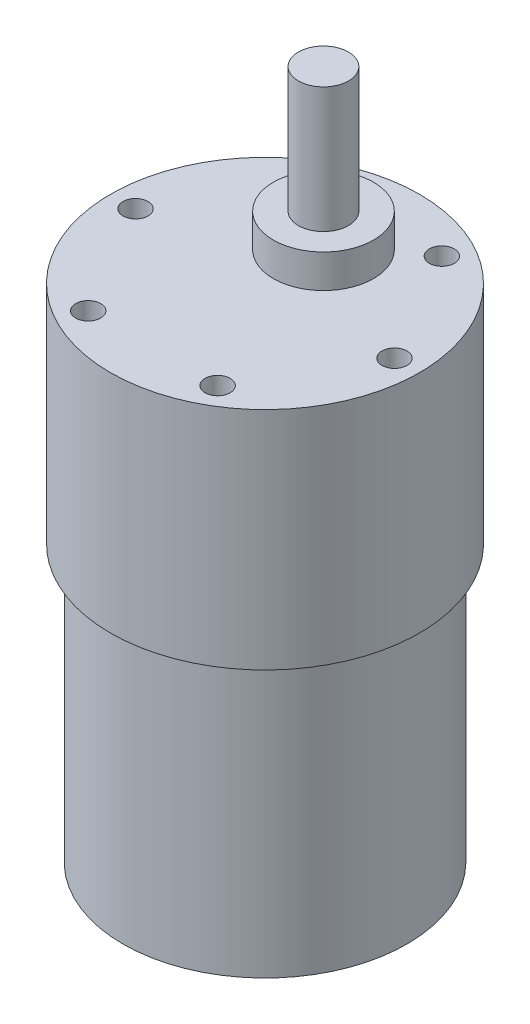
from build123d import *

# Parameters (mm, degrees)
SKETCH_1_R          = 17
EXTRUDE_1_DEPTH     = 33
SKETCH_2_R          = 18.5
EXTRUDE_2_DEPTH     = 27
SKETCH_3_R          = 6
EXTRUDE_3_DEPTH     = 4
SKETCH_4_R          = 3
EXTRUDE_5_DEPTH     = 15
SKETCH_6_R          = 1.5
CUT_EXTRUDE_1_DEPTH = 5


with BuildPart() as part:
    # 草图1 → 凸台-拉伸1 (new body)
    with BuildSketch(Plane(origin=(0, 0, 0), x_dir=(1, 0, 0), z_dir=(0, 1, 0))):
        with Locations(Location((0, 0, 0), (0, 0, 270))):
            Circle(SKETCH_1_R)
    extrude(amount=EXTRUDE_1_DEPTH)

    # 草图2 → 凸台-拉伸2 (add)
    with BuildSketch(Plane(origin=(0, 33, 0), x_dir=(1, 0, 0), z_dir=(0, 1, 0))):
        with Locations(Location((0, 0, 0), (0, 0, 270))):
            Circle(SKETCH_2_R)
    extrude(amount=EXTRUDE_2_DEPTH)

    # 草图3 → 凸台-拉伸3 (add)
    with BuildSketch(Plane(origin=(0, 60, 0), x_dir=(1, 0, 0), z_dir=(0, 1, 0))):
        with Locations(Location((0, 7, 0), (0, 0, 270))):
            Circle(SKETCH_3_R)
    extrude(amount=EXTRUDE_3_DEPTH)

    # 草图4 → 凸台-拉伸5 (add)
    with BuildSketch(Plane(origin=(0, 64, 0), x_dir=(1, 0, 0), z_dir=(0, 1, 0))):
        with Locations(Location((0, 7, 0), (0, 0, 270))):
            Circle(SKETCH_4_R)
    extrude(amount=EXTRUDE_5_DEPTH)

    # 草图6 → 切除-拉伸1 (cut)
    with BuildSketch(Plane(origin=(0, 60, 0), x_dir=(1, 0, 0), z_dir=(0, 1, 0))):
        with Locations(Location((7.75, 13.423393759, 0), (0, 0, 270))):
            Circle(SKETCH_6_R)
        with Locations(Location((15.5, 0, 0), (0, 0, 270))):
            Circle(SKETCH_6_R)
        with Locations(Location((7.75, -13.423393759, 0), (0, 0, 270))):
            Circle(SKETCH_6_R)
        with Locations(Location((-7.75, -13.423393759, 0), (0, 0, 270))):
            Circle(SKETCH_6_R)
        with Locations(Location((-15.5, 0, 0), (0, 0, 270))):
            Circle(SKETCH_6_R)
        with Locations(Location((-7.75, 13.423393759, 0), (0, 0, 270))):
            Circle(SKETCH_6_R)
    extrude(amount=-CUT_EXTRUDE_1_DEPTH, mode=Mode.SUBTRACT)


solid = part.part
